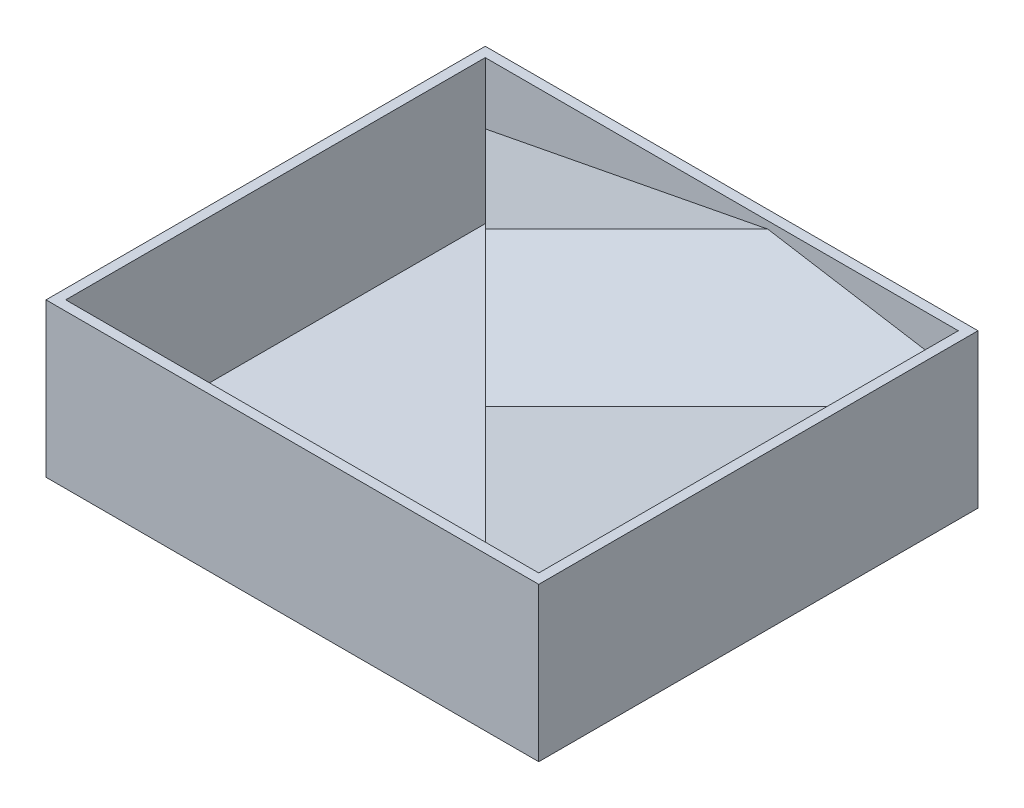
from build123d import *

# Parameters (mm, degrees)
SKETCH1_W                  = 127.078191072
SKETCH1_H                  = 113.282646321
BOSS_EXTRUDE1_DEPTH        = 39.624
SHELL_1_T                  = -2.54
OFFICIAL_RIB_BLOCK20_REACH = 100.208


with BuildPart() as part:
    # Sketch1 → Boss-Extrude1 (new body)
    with BuildSketch(Plane(origin=(0, 0, 0), x_dir=(1, 0, 0), z_dir=(0, 1, 0))):
        with Locations((1.06119575, 7.295720781)):
            Rectangle(SKETCH1_W, SKETCH1_H)
    extrude(amount=BOSS_EXTRUDE1_DEPTH)

    # 抽壳1
    shell_1_openings = [part.faces().sort_by_distance(p)[0] for p in [
        (1.06119575, 39.624, -7.295720782),
    ]]
    offset(amount=SHELL_1_T, openings=shell_1_openings, kind=Kind.INTERSECTION)

    # 草图1 walls → official_rib_block20 (add, up to next)
    with BuildSketch(Plane(origin=(0.729572078, 0, -0.729572078), x_dir=(0.7071067811865477, 0, 0.7071067811865475), z_dir=(-0.7071067811865475, 0, 0.7071067811865477)), mode=Mode.PRIVATE) as official_rib_block20_sk1:
        Polygon((-181.514338156, -5.000960726), (-34.23, 35.134), (7.726, 25.357), (209.797270961, 53.134303954), (209.451367988, 55.650640802), (7.84521248, 27.93727297), (-34.278590113, 37.753375981), (-182.182137615, -2.550319201), align=None)
    official_rib_block20_tool1 = extrude(official_rib_block20_sk1.sketch, amount=-OFFICIAL_RIB_BLOCK20_REACH, mode=Mode.PRIVATE) - part.part
    add(official_rib_block20_tool1.solids().sort_by_distance((-8.641006986, 30.2455, -10.100151142))[0])


solid = part.part
